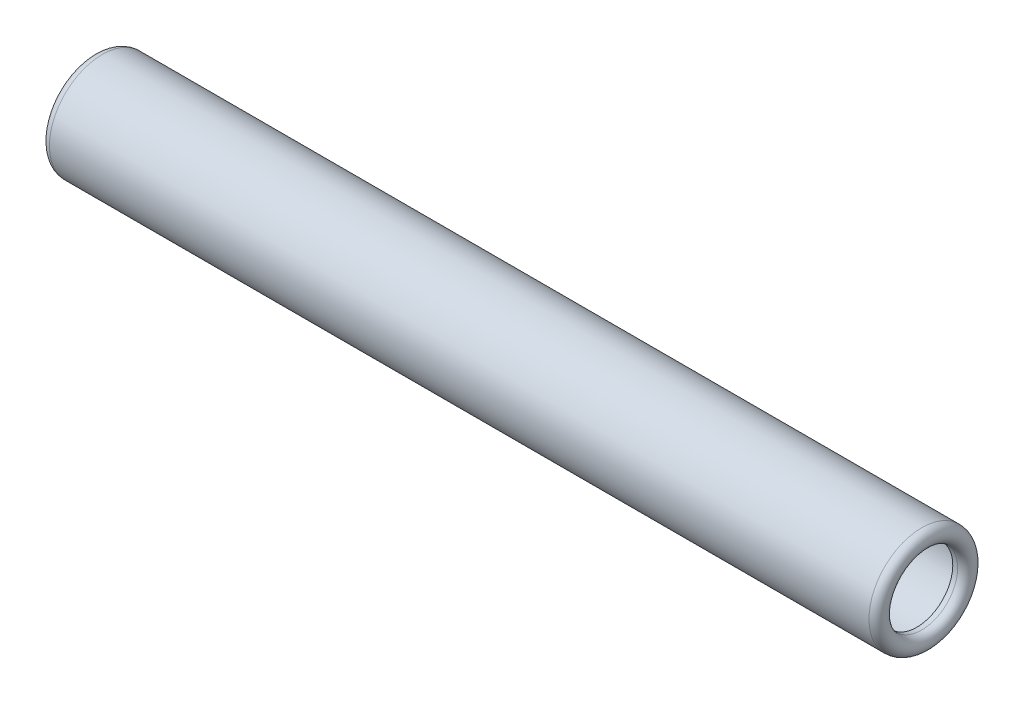
from build123d import *


with BuildPart() as part:
    # Sketch1 → Revolve1 (revolve)
    with BuildSketch(Plane.XY):
        with BuildLine():
            Line((4.8, 12.95), (4.8, 14.15))
            Line((4.8, 14.15), (3.05, 14.15))
            ThreePointArc((3.05, 14.15), (1.2, 16), (3.05, 17.85))
            Line((3.05, 17.85), (298.95, 17.85))
            ThreePointArc((298.95, 17.85), (300.8, 16), (298.95, 14.15))
            Line((298.95, 14.15), (297.2, 14.15))
            Line((297.2, 14.15), (297.2, 12.95))
            Line((297.2, 12.95), (298.95, 12.95))
            ThreePointArc((298.95, 12.95), (302, 16), (298.95, 19.05))
            Line((298.95, 19.05), (3.05, 19.05))
            ThreePointArc((3.05, 19.05), (0, 16), (3.05, 12.95))
            Line((3.05, 12.95), (4.8, 12.95))
        make_face()
    revolve(axis=Axis((307.5, 0, 0), (-1, 0, 0)))


solid = part.part
